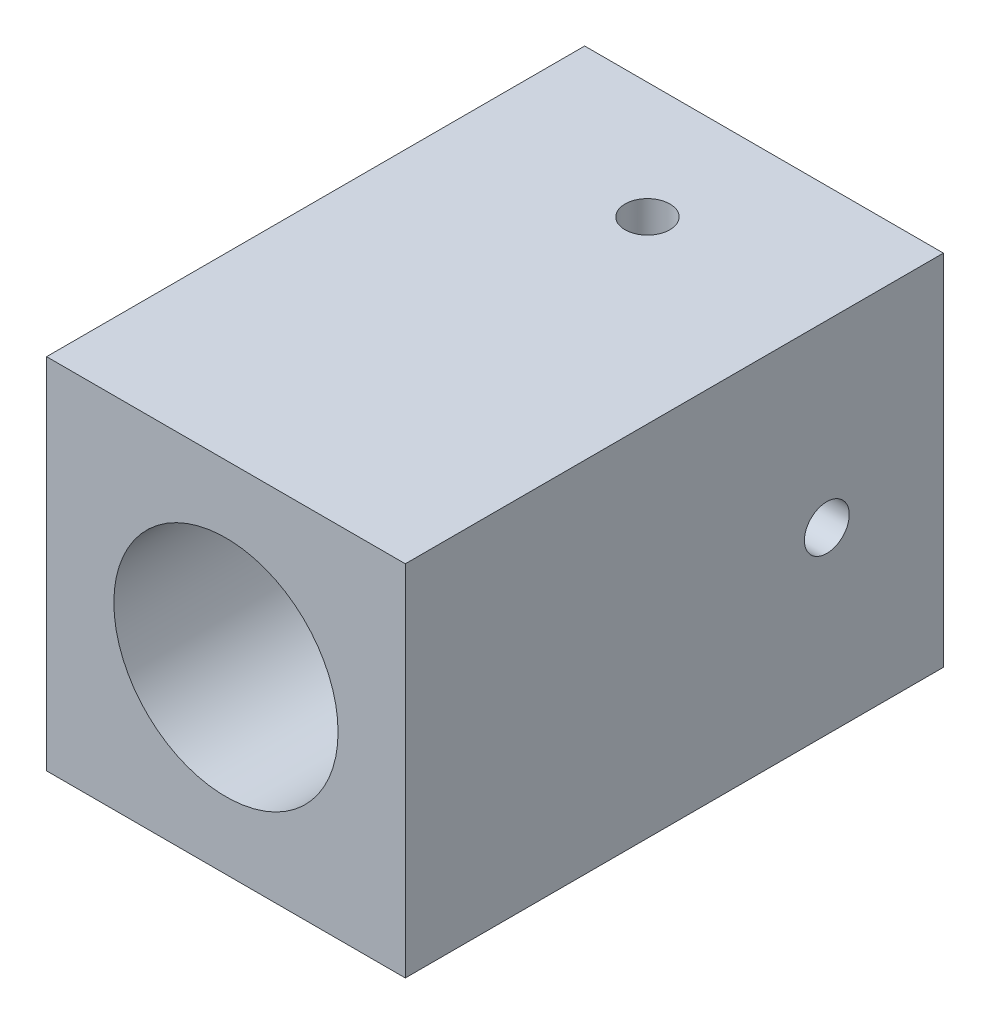
from build123d import *

# Parameters (mm, degrees)
SKETCH_1_W          = 40
SKETCH_1_H          = 40
EXTRUDE_1_DEPTH     = 60
SKETCH_7_R          = 2.5
CUT_EXTRUDE_1_DEPTH = 10
SKETCH_8_R          = 2.5
CUT_EXTRUDE_2_DEPTH = 10
SKETCH_10_R         = 12.5
CUT_EXTRUDE_3_DEPTH = 40


with BuildPart() as part:
    # 草图1 → 凸台-拉伸1 (new body)
    with BuildSketch(Plane.XY):
        Rectangle(SKETCH_1_W, SKETCH_1_H)
    extrude(amount=EXTRUDE_1_DEPTH)

    # 草图7 → 切除-拉伸1 (cut)
    with BuildSketch(Plane.XZ.offset(20)):
        with Locations(Location((0, 13, 0), (0, 0, 270))):
            Circle(SKETCH_7_R)
    cut_extrude_1 = extrude(amount=-CUT_EXTRUDE_1_DEPTH, mode=Mode.SUBTRACT)

    # 草图8 → 切除-拉伸2 (cut)
    with BuildSketch(Plane(origin=(20, 0, 0), x_dir=(0, 0, -1), z_dir=(1, 0, 0))):
        with Locations((-13, 0)):
            Circle(SKETCH_8_R)
    cut_extrude_2 = extrude(amount=-CUT_EXTRUDE_2_DEPTH, mode=Mode.SUBTRACT)

    # 镜向1: 切除-拉伸1 across plane
    add(cut_extrude_1.mirror(Plane.ZX), mode=Mode.SUBTRACT)

    # 镜向2: 切除-拉伸2 across plane
    add(cut_extrude_2.mirror(Plane(origin=(0, 0, 0), x_dir=(0, 0, 1), z_dir=(1, 0, 0))), mode=Mode.SUBTRACT)

    # 草图10 → 切除-拉伸3 (cut)
    with BuildSketch(Plane.XY.offset(60)):
        Circle(SKETCH_10_R)
    extrude(amount=-CUT_EXTRUDE_3_DEPTH, mode=Mode.SUBTRACT)


solid = part.part
